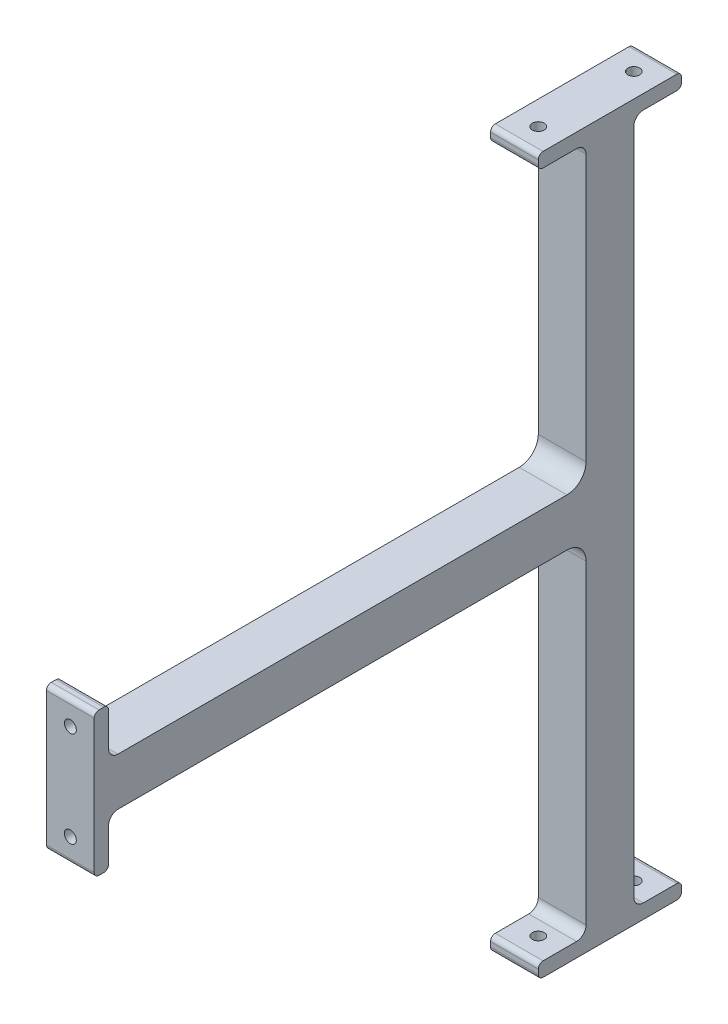
from build123d import *

# Parameters (mm, degrees)
BOSS_EXTRUDE1_DEPTH          = 12.7
SKETCH2_R                    = 1.5875
SIDE_MOUNT_HOLES_DEPTH       = 12.7
SKETCH3_R                    = 1.5875
TOP_BOTTOM_MOUNT_HOLES_DEPTH = 12.7
FILLET1_R                    = 2.54
FILLET2_R                    = 5.08
FILLET3_R                    = 1.27


with BuildPart() as part:
    # Sketch1 → Boss-Extrude1 (new body)
    with BuildSketch(Plane(origin=(0, 0, 0), x_dir=(0, 0, -1), z_dir=(1, 0, 0))):
        Polygon((0, 0), (-19.05, 0), (-19.05, 3.81), (-6.35, 3.81), (-6.35, 95.25), (-133.35, 95.25), (-133.35, 82.55), (-137.16, 82.55), (-137.16, 120.65), (-133.35, 120.65), (-133.35, 107.95), (-6.35, 107.95), (-6.35, 186.436), (-19.05, 186.436), (-19.05, 190.246), (19.05, 190.246), (19.05, 186.436), (6.35, 186.436), (6.35, 3.81), (19.05, 3.81), (19.05, 0), align=None)
    extrude(amount=BOSS_EXTRUDE1_DEPTH)

    # Sketch2 → Side_mount_holes (cut)
    with BuildSketch(Plane.XY.offset(137.16)):
        with Locations((6.35, 114.3)):
            Circle(SKETCH2_R)
        with Locations(Location((6.35, 88.9, 0), (0, 0, 270))):
            Circle(SKETCH2_R)
    extrude(amount=-SIDE_MOUNT_HOLES_DEPTH, mode=Mode.SUBTRACT)

    # Sketch3 → top_Bottom_mount_holes (cut)
    with BuildSketch(Plane.XZ):
        with Locations(Location((6.35, 12.7, 0), (0, 0, 270))):
            Circle(SKETCH3_R)
        with Locations(Location((6.35, -12.7, 0), (0, 0, 270))):
            Circle(SKETCH3_R)
    top_bottom_mount_holes = extrude(amount=-TOP_BOTTOM_MOUNT_HOLES_DEPTH, mode=Mode.SUBTRACT)

    # Mirror1: top_Bottom_mount_holes across plane
    add(top_bottom_mount_holes.mirror(Plane(origin=(0, 95.123, 0), x_dir=(0, 0, 1), z_dir=(0, -1, 0))), mode=Mode.SUBTRACT)

    # Fillet1
    fillet1_edges = [part.edges().sort_by_distance(p)[0] for p in [
        (6.35, 3.81, 6.35),
        (6.35, 95.25, 133.35),
        (6.35, 107.95, 133.35),
        (6.35, 186.436, 6.35),
        (6.35, 186.436, -6.35),
        (6.35, 3.81, -6.35),
    ]]
    fillet(fillet1_edges, radius=FILLET1_R)

    # Fillet2
    fillet2_edges = [part.edges().sort_by_distance(p)[0] for p in [
        (6.35, 95.25, 6.35),
        (6.35, 107.95, 6.35),
    ]]
    fillet(fillet2_edges, radius=FILLET2_R)

    # Fillet3
    fillet3_edges = [part.edges().sort_by_distance(p)[0] for p in [
        (6.35, 0, 19.05),
        (6.35, 3.81, 19.05),
        (6.35, 82.55, 133.35),
        (6.35, 82.55, 137.16),
        (6.35, 120.65, 137.16),
        (6.35, 120.65, 133.35),
        (6.35, 186.436, 19.05),
        (6.35, 190.246, 19.05),
        (6.35, 190.246, -19.05),
        (6.35, 186.436, -19.05),
        (6.35, 3.81, -19.05),
        (6.35, 0, -19.05),
    ]]
    fillet(fillet3_edges, radius=FILLET3_R)


solid = part.part
